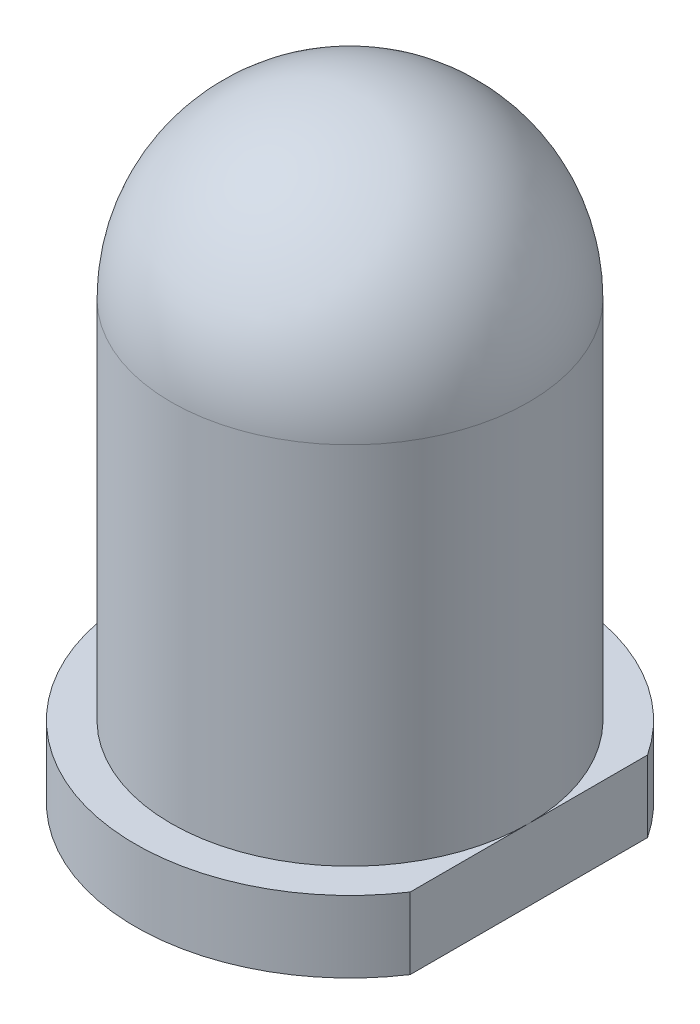
from build123d import *

# Parameters (mm, degrees)
SKETCH_2_R          = 3
EXTRUDE_1_DEPTH     = 1
CUT_EXTRUDE_1_DEPTH = 10.589577676


with BuildPart() as part:
    # Эскиз1 → Повернуть1 (revolve)
    with BuildSketch(Plane.XY, mode=Mode.PRIVATE) as revolve_1_sk:
        with BuildLine():
            Line((0, 0), (0, 8.6))
            ThreePointArc((0, 8.6), (-1.767766953, 7.867766953), (-2.5, 6.1))
            Line((-2.5, 6.1), (-2.5, 0))
            Line((-2.5, 0), (0, 0))
        make_face()
    revolve(revolve_1_sk.sketch.rotate(Axis((0, 0, 0), (0, -1, 0)), 180), axis=Axis((0, 0, 0), (0, -1, 0)))

    # Эскиз2 → Бобышка-Вытянуть1 (add)
    with BuildSketch(Plane.XZ):
        with Locations(Location((0, 0, 0), (0, 0, 270))):
            Circle(SKETCH_2_R)
    extrude(amount=-EXTRUDE_1_DEPTH)

    # Эскиз3 → Вырез-Вытянуть1 (cut, through all)
    with BuildSketch(Plane(origin=(0, 0, 0), x_dir=(1, 0, 0), z_dir=(0, 1, 0))):
        Polygon((2.5, 26.073564647), (2.5, 1.658312395), (2.5, -1.658312395), (2.5, -26.073564647), (51.330504504, -26.073564647), (51.330504504, 26.073564647), align=None)
    extrude(amount=CUT_EXTRUDE_1_DEPTH, mode=Mode.SUBTRACT)


solid = part.part
